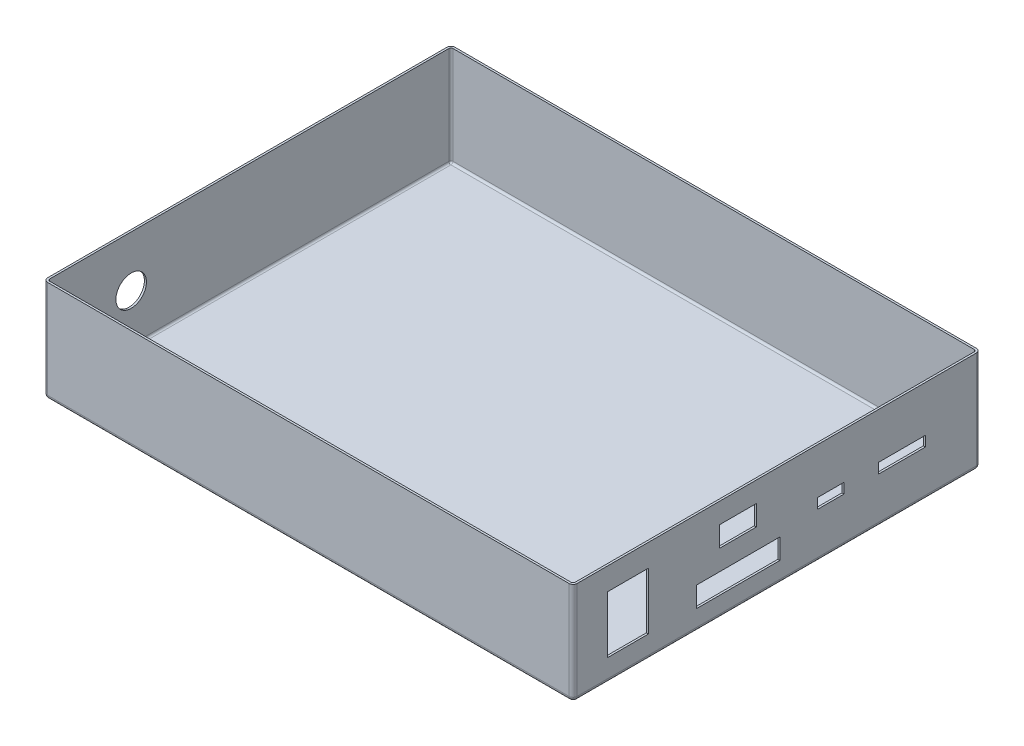
from build123d import *

# Parameters (mm, degrees)
SKETCH1_W           = 260
SKETCH1_H           = 200
BOSS_EXTRUDE1_DEPTH = 50
FILLET1_R           = 2
SHELL1_T            = -1
SKETCH2_W           = 41
SKETCH2_H           = 10
SKETCH2_W_2         = 18
SKETCH2_W_3         = 13
SKETCH2_H_2         = 5
SKETCH2_W_4         = 23
SKETCH2_W_5         = 20
SKETCH2_H_3         = 28
CUT_EXTRUDE1_DEPTH  = 50
SKETCH3_R           = 7.5
CUT_EXTRUDE2_DEPTH  = 50


with BuildPart() as part:
    # Sketch1 → Boss-Extrude1 (new body)
    with BuildSketch(Plane(origin=(0, 0, 0), x_dir=(1, 0, 0), z_dir=(0, 1, 0))):
        Rectangle(SKETCH1_W, SKETCH1_H)
    extrude(amount=BOSS_EXTRUDE1_DEPTH)

    # Fillet1
    fillet1_edges = [part.edges().sort_by_distance(p)[0] for p in [
        (0, 0, -100),
        (130, 0, 0),
        (0, 0, 100),
        (-130, 0, 0),
        (-130, 25, -100),
        (130, 25, -100),
        (130, 25, 100),
        (-130, 25, 100),
    ]]
    fillet(fillet1_edges, radius=FILLET1_R)

    # Shell1
    shell1_openings = [part.faces().sort_by_distance(p)[0] for p in [
        (0, 50, 0),
    ]]
    offset(amount=SHELL1_T, openings=shell1_openings, kind=Kind.INTERSECTION)

    # Sketch2 → Cut-Extrude1 (cut)
    with BuildSketch(Plane(origin=(130, 0, 0), x_dir=(0, 0, -1), z_dir=(1, 0, 0))):
        with Locations((-19, 15)):
            Rectangle(SKETCH2_W, SKETCH2_H)
        with Locations((-19, 35)):
            Rectangle(SKETCH2_W_2, SKETCH2_H)
        with Locations((26.5, 25)):
            Rectangle(SKETCH2_W_3, SKETCH2_H_2)
        with Locations((61.5, 25)):
            Rectangle(SKETCH2_W_4, SKETCH2_H_2)
        with Locations((-73, 25)):
            Rectangle(SKETCH2_W_5, SKETCH2_H_3)
    extrude(amount=-CUT_EXTRUDE1_DEPTH, mode=Mode.SUBTRACT)

    # Sketch3 → Cut-Extrude2 (cut)
    with BuildSketch(Plane.ZY.offset(130)):
        with Locations((58, 25)):
            Circle(SKETCH3_R)
    extrude(amount=-CUT_EXTRUDE2_DEPTH, mode=Mode.SUBTRACT)


solid = part.part
